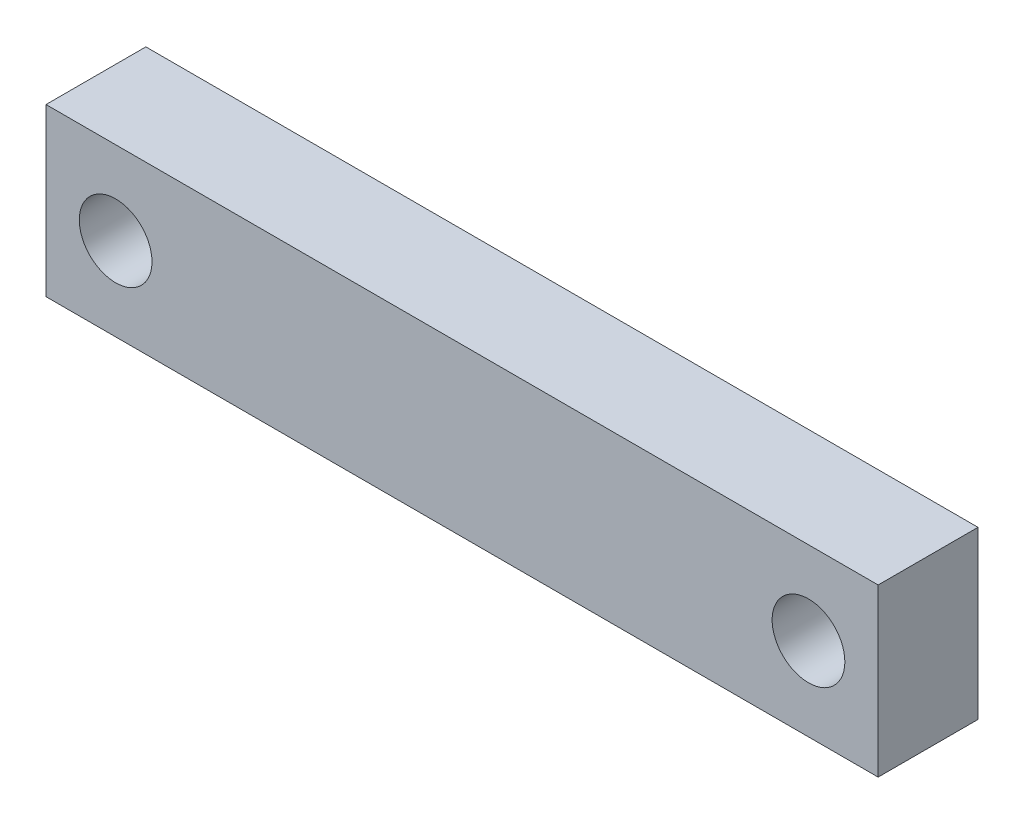
from build123d import *

# Parameters (mm, degrees)
SKETCH2_W                   = 25
SKETCH2_H                   = 5
BOSS_EXTRUDE1_DEPTH         = 3
F_44_0_086_DIAMETER_HOLE1_D = 2.1844


with BuildPart() as part:
    # Sketch2 → Boss-Extrude1 (new body)
    with BuildSketch(Plane.XY):
        Rectangle(SKETCH2_W, SKETCH2_H)
    extrude(amount=BOSS_EXTRUDE1_DEPTH)

    # #44 (0.086) Diameter Hole1 (through all)
    with Locations(Plane(origin=(-10.4078, 0, 3), x_dir=(1, 0, 0), z_dir=(0, 0, 1))):
        with Locations((0, 0), (20.8156, 0)):
            Hole(F_44_0_086_DIAMETER_HOLE1_D / 2)


solid = part.part
